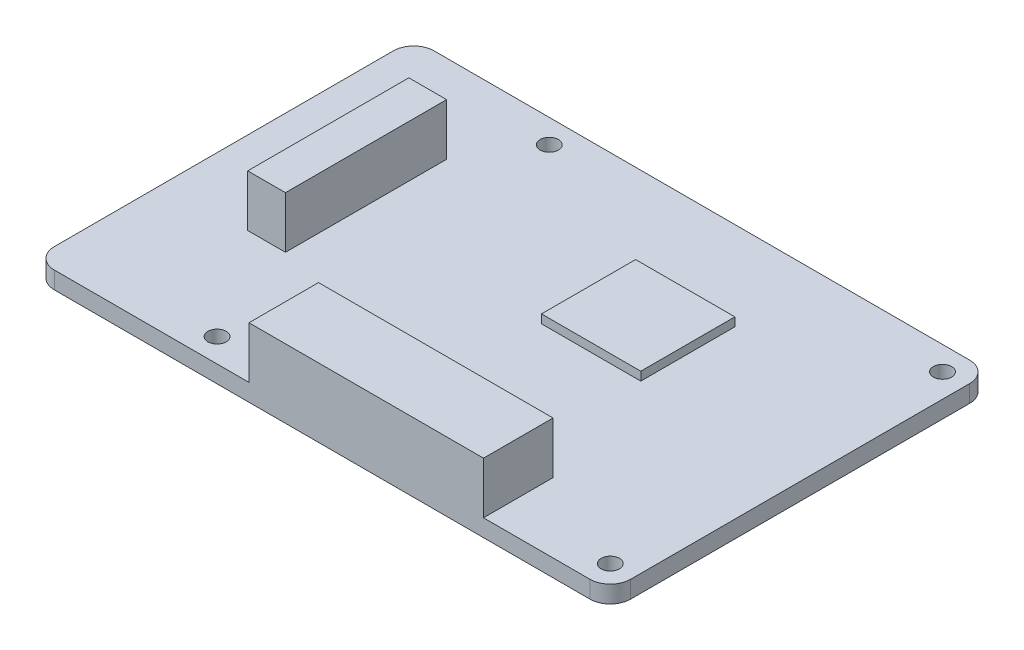
from build123d import *

# Parameters (mm, degrees)
SKETCH1_R           = 1.35
BOSS_EXTRUDE1_DEPTH = 2.54
SKETCH2_W           = 34.5908584
SKETCH2_H           = 10.2596717
BOSS_EXTRUDE2_DEPTH = 7.62
SKETCH3_W           = 5.570985132
SKETCH3_H           = 23.769243549
BOSS_EXTRUDE3_DEPTH = 7.62
SKETCH4_W           = 14.639482868
SKETCH4_H           = 13.879415804
BOSS_EXTRUDE4_DEPTH = 1.27


with BuildPart() as part:
    # Sketch1 → Boss-Extrude1 (new body)
    with BuildSketch(Plane(origin=(0, 0, 0), x_dir=(1, 0, 0), z_dir=(0, 1, 0))):
        with BuildLine():
            ThreePointArc((42.5, 25.000002241), (41.621321, 27.121321), (39.500002241, 28))
            Line((39.500002241, 28), (-39.500002241, 28))
            ThreePointArc((-39.500002241, 28), (-41.621321, 27.121321), (-42.5, 25.000002241))
            Line((-42.5, 25.000002241), (-42.5, -25.000002241))
            ThreePointArc((-42.5, -25.000002241), (-41.621321, -27.121321), (-39.500002241, -28))
            Line((-39.500002241, -28), (39.500002241, -28))
            ThreePointArc((39.500002241, -28), (41.621321, -27.121321), (42.5, -25.000002241))
            Line((42.5, -25.000002241), (42.5, 25.000002241))
        make_face()
        with Locations((-19, -24.5)):
            Circle(SKETCH1_R, mode=Mode.SUBTRACT)
        with Locations((39, -24.5)):
            Circle(SKETCH1_R, mode=Mode.SUBTRACT)
        with Locations((-19, 24.5)):
            Circle(SKETCH1_R, mode=Mode.SUBTRACT)
        with Locations((39, 24.5)):
            Circle(SKETCH1_R, mode=Mode.SUBTRACT)
    extrude(amount=BOSS_EXTRUDE1_DEPTH)

    # Sketch2 → Boss-Extrude2 (add)
    with BuildSketch(Plane(origin=(0, 2.54, 0), x_dir=(1, 0, 0), z_dir=(0, 1, 0))):
        with Locations((6.499175034, -22.87016415)):
            Rectangle(SKETCH2_W, SKETCH2_H)
    extrude(amount=BOSS_EXTRUDE2_DEPTH)

    # Sketch3 → Boss-Extrude3 (add)
    with BuildSketch(Plane(origin=(0, 2.54, 0), x_dir=(1, 0, 0), z_dir=(0, 1, 0))):
        with Locations((-27.506444174, 3.193413678)):
            Rectangle(SKETCH3_W, SKETCH3_H)
    extrude(amount=BOSS_EXTRUDE3_DEPTH)

    # Sketch4 → Boss-Extrude4 (add)
    with BuildSketch(Plane(origin=(0, 2.54, 0), x_dir=(1, 0, 0), z_dir=(0, 1, 0))):
        with Locations((10.616389604, 7.997233107)):
            Rectangle(SKETCH4_W, SKETCH4_H)
    extrude(amount=BOSS_EXTRUDE4_DEPTH)


solid = part.part
